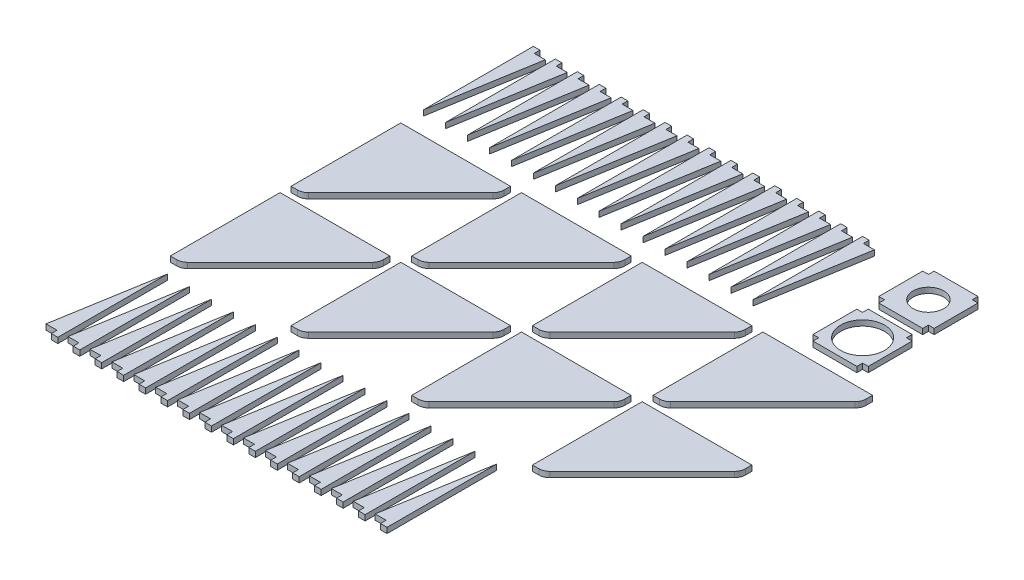
from build123d import *

# Parameters (mm, degrees)
SKETCH2_W               = 304.8
SKETCH2_H               = 304.8
BOSS_EXTRUDE1_DEPTH     = 3.175
CUT_EXTRUDE1_DEPTH      = 348.408852067
CUT_EXTRUDE1_DEPTH_BACK = 348.408852067
SKETCH3_W               = 304.8
SKETCH3_H               = 304.8
SKETCH3_R               = 12.7
SKETCH3_R_2             = 8.89


with BuildPart() as part:
    # Sketch2 → Boss-Extrude1 (new body)
    with BuildSketch(Plane(origin=(0, 0, 0), x_dir=(1, 0, 0), z_dir=(0, 1, 0))):
        with Locations((-56.763509666, -124.968808797)):
            Rectangle(SKETCH2_W, SKETCH2_H)
    extrude(amount=BOSS_EXTRUDE1_DEPTH)

    # Sketch3 → Cut-Extrude1 (cut, two sides: drawn at the far end of the back side and taken through both)
    # profile 1 of 3: a face of its own
    with BuildSketch(Plane(origin=(0, 3.175, 0), x_dir=(1, 0, 0), z_dir=(0, 1, 0)).offset(-CUT_EXTRUDE1_DEPTH_BACK)):
        with Locations((-56.763509666, -124.968808797)):
            Rectangle(SKETCH3_W, SKETCH3_H)
        Polygon((-188.253637726, -268.695366412), (-192.063637726, -268.695366412), (-192.063637726, -265.393366412), (-198.413637726, -265.393366412), (-188.253637726, -205.195366412), align=None, mode=Mode.SUBTRACT)
        Polygon((-185.713637726, -265.393366412), (-175.553637726, -205.195366412), (-175.553637726, -268.695366412), (-179.363637726, -268.695366412), (-179.363637726, -265.393366412), align=None, mode=Mode.SUBTRACT)
        Polygon((-162.853637726, -268.695366412), (-166.663637726, -268.695366412), (-166.663637726, -265.393366412), (-173.013637726, -265.393366412), (-162.853637726, -205.195366412), align=None, mode=Mode.SUBTRACT)
        Polygon((-150.153637726, -268.695366412), (-153.963637726, -268.695366412), (-153.963637726, -265.393366412), (-160.313637726, -265.393366412), (-150.153637726, -205.195366412), align=None, mode=Mode.SUBTRACT)
        Polygon((-147.613637726, -265.393366412), (-137.453637726, -205.195366412), (-137.453637726, -268.695366412), (-141.263637726, -268.695366412), (-141.263637726, -265.393366412), align=None, mode=Mode.SUBTRACT)
        Polygon((-128.563637726, -265.393366412), (-134.913637726, -265.393366412), (-124.753637726, -205.195366412), (-124.753637726, -268.695366412), (-128.563637726, -268.695366412), align=None, mode=Mode.SUBTRACT)
        Polygon((-122.213637726, -265.393366412), (-112.053637726, -205.195366412), (-112.053637726, -268.695366412), (-115.863637726, -268.695366412), (-115.863637726, -265.393366412), align=None, mode=Mode.SUBTRACT)
        Polygon((-99.353637726, -268.695366412), (-103.163637726, -268.695366412), (-103.163637726, -265.393366412), (-109.513637726, -265.393366412), (-99.353637726, -205.195366412), align=None, mode=Mode.SUBTRACT)
        Polygon((-90.463637726, -268.695366412), (-90.463637726, -265.393366412), (-96.813637726, -265.393366412), (-86.653637726, -205.195366412), (-86.653637726, -268.695366412), align=None, mode=Mode.SUBTRACT)
        Polygon((-84.113637726, -265.393366412), (-73.953637726, -205.195366412), (-73.953637726, -268.695366412), (-77.763637726, -268.695366412), (-77.763637726, -265.393366412), align=None, mode=Mode.SUBTRACT)
        Polygon((-71.413637726, -265.393366412), (-61.253637726, -205.195366412), (-61.253637726, -268.695366412), (-65.063637726, -268.695366412), (-65.063637726, -265.393366412), align=None, mode=Mode.SUBTRACT)
        with BuildLine():
            ThreePointArc((-132.963509666, -135.600090559), (-133.446874634, -138.030130355), (-134.823381605, -140.09021862))
            Line((-134.823381605, -140.09021862), (-188.253637726, -193.520474741))
            ThreePointArc((-188.253637726, -193.520474741), (-190.313725991, -194.896981712), (-192.743765787, -195.38034668))
            Line((-192.743765787, -195.38034668), (-196.463509666, -195.38034668))
            Line((-196.463509666, -195.38034668), (-196.463509666, -131.88034668))
            Line((-196.463509666, -131.88034668), (-132.963509666, -131.88034668))
            Line((-132.963509666, -131.88034668), (-132.963509666, -135.600090559))
        make_face(mode=Mode.SUBTRACT)
        with BuildLine():
            Line((-126.613509666, -195.38034668), (-126.613509666, -131.88034668))
            Line((-126.613509666, -131.88034668), (-63.113509666, -131.88034668))
            Line((-63.113509666, -131.88034668), (-63.113509666, -135.600090559))
            ThreePointArc((-63.113509666, -135.600090559), (-63.596874634, -138.030130355), (-64.973381605, -140.09021862))
            Line((-64.973381605, -140.09021862), (-118.403637726, -193.520474741))
            ThreePointArc((-118.403637726, -193.520474741), (-120.463725991, -194.896981712), (-122.893765787, -195.38034668))
            Line((-122.893765787, -195.38034668), (-126.613509666, -195.38034668))
        make_face(mode=Mode.SUBTRACT)
        Polygon((-52.363637726, -268.695366412), (-52.363637726, -265.393366412), (-58.713637726, -265.393366412), (-48.553637726, -205.195366412), (-48.553637726, -268.695366412), align=None, mode=Mode.SUBTRACT)
        Polygon((-35.853637726, -205.195366412), (-35.853637726, -268.695366412), (-39.663637726, -268.695366412), (-39.663637726, -265.393366412), (-46.013637726, -265.393366412), align=None, mode=Mode.SUBTRACT)
        Polygon((-23.153637726, -205.195366412), (-23.153637726, -268.695366412), (-26.963637726, -268.695366412), (-26.963637726, -265.393366412), (-33.313637726, -265.393366412), align=None, mode=Mode.SUBTRACT)
        Polygon((-20.613637726, -265.393366412), (-10.453637726, -205.195366412), (-10.453637726, -268.695366412), (-14.263637726, -268.695366412), (-14.263637726, -265.393366412), align=None, mode=Mode.SUBTRACT)
        Polygon((-1.563637726, -268.695366412), (-1.563637726, -265.393366412), (-7.913637726, -265.393366412), (2.246362274, -205.195366412), (2.246362274, -268.695366412), align=None, mode=Mode.SUBTRACT)
        with BuildLine():
            Line((-53.043765787, -195.38034668), (-56.763509666, -195.38034668))
            Line((-56.763509666, -195.38034668), (-56.763509666, -131.88034668))
            Line((-56.763509666, -131.88034668), (6.736490334, -131.88034668))
            Line((6.736490334, -131.88034668), (6.736490334, -135.600090559))
            ThreePointArc((6.736490334, -135.600090559), (6.253125366, -138.030130355), (4.876618395, -140.09021862))
            Line((4.876618395, -140.09021862), (-48.553637726, -193.520474741))
            ThreePointArc((-48.553637726, -193.520474741), (-50.613725991, -194.896981712), (-53.043765787, -195.38034668))
        make_face(mode=Mode.SUBTRACT)
        with BuildLine():
            Line((13.086490334, -131.88034668), (76.586490334, -131.88034668))
            Line((76.586490334, -131.88034668), (76.586490334, -135.600090559))
            ThreePointArc((76.586490334, -135.600090559), (76.103125366, -138.030130355), (74.726618395, -140.09021862))
            Line((74.726618395, -140.09021862), (21.296362274, -193.520474741))
            ThreePointArc((21.296362274, -193.520474741), (19.236274009, -194.896981712), (16.806234213, -195.38034668))
            Line((16.806234213, -195.38034668), (13.086490334, -195.38034668))
            Line((13.086490334, -195.38034668), (13.086490334, -131.88034668))
        make_face(mode=Mode.SUBTRACT)
        with BuildLine():
            Line((-196.463509666, -125.53034668), (-196.463509666, -62.03034668))
            Line((-196.463509666, -62.03034668), (-132.963509666, -62.03034668))
            Line((-132.963509666, -62.03034668), (-132.963509666, -65.750090559))
            ThreePointArc((-132.963509666, -65.750090559), (-133.10773728, -67.095783354), (-133.533868437, -68.38034668))
            ThreePointArc((-133.533868437, -68.38034668), (-134.095097913, -69.368194866), (-134.823381605, -70.24021862))
            Line((-134.823381605, -70.24021862), (-188.253637726, -123.670474741))
            ThreePointArc((-188.253637726, -123.670474741), (-189.12566148, -124.398758433), (-190.113509666, -124.959987909))
            ThreePointArc((-190.113509666, -124.959987909), (-191.398072992, -125.386119066), (-192.743765787, -125.53034668))
            Line((-192.743765787, -125.53034668), (-196.463509666, -125.53034668))
        make_face(mode=Mode.SUBTRACT)
        with BuildLine():
            Line((-122.893765787, -125.53034668), (-126.613509666, -125.53034668))
            Line((-126.613509666, -125.53034668), (-126.613509666, -62.03034668))
            Line((-126.613509666, -62.03034668), (-63.113509666, -62.03034668))
            Line((-63.113509666, -62.03034668), (-63.113509666, -65.750090559))
            ThreePointArc((-63.113509666, -65.750090559), (-63.596874634, -68.180130355), (-64.973381605, -70.24021862))
            Line((-64.973381605, -70.24021862), (-118.403637726, -123.670474741))
            ThreePointArc((-118.403637726, -123.670474741), (-120.463725991, -125.046981712), (-122.893765787, -125.53034668))
        make_face(mode=Mode.SUBTRACT)
        Polygon((-196.463509666, -48.768808797), (-196.463509666, 14.731191203), (-192.653509666, 14.731191203), (-192.653509666, 11.429191203), (-186.303509666, 11.429191203), align=None, mode=Mode.SUBTRACT)
        Polygon((-183.763509666, 14.731191203), (-179.953509666, 14.731191203), (-179.953509666, 11.429191203), (-173.603509666, 11.429191203), (-183.763509666, -48.768808797), align=None, mode=Mode.SUBTRACT)
        Polygon((-171.063509666, 14.731191203), (-167.253509666, 14.731191203), (-167.253509666, 11.429191203), (-160.903509666, 11.429191203), (-171.063509666, -48.768808797), align=None, mode=Mode.SUBTRACT)
        Polygon((-158.363509666, 14.731191203), (-154.553509666, 14.731191203), (-154.553509666, 11.429191203), (-148.203509666, 11.429191203), (-158.363509666, -48.768808797), align=None, mode=Mode.SUBTRACT)
        Polygon((-145.663509666, 14.731191203), (-141.853509666, 14.731191203), (-141.853509666, 11.429191203), (-135.503509666, 11.429191203), (-145.663509666, -48.768808797), align=None, mode=Mode.SUBTRACT)
        Polygon((-132.963509666, 14.731191203), (-129.153509666, 14.731191203), (-129.153509666, 11.429191203), (-122.803509666, 11.429191203), (-132.963509666, -48.768808797), align=None, mode=Mode.SUBTRACT)
        Polygon((-120.263509666, 14.731191203), (-116.453509666, 14.731191203), (-116.453509666, 11.429191203), (-110.103509666, 11.429191203), (-120.263509666, -48.768808797), align=None, mode=Mode.SUBTRACT)
        Polygon((-107.563509666, 14.731191203), (-103.753509666, 14.731191203), (-103.753509666, 11.429191203), (-97.403509666, 11.429191203), (-107.563509666, -48.768808797), align=None, mode=Mode.SUBTRACT)
        Polygon((-94.863509666, 14.731191203), (-91.053509666, 14.731191203), (-91.053509666, 11.429191203), (-84.703509666, 11.429191203), (-94.863509666, -48.768808797), align=None, mode=Mode.SUBTRACT)
        Polygon((-82.163509666, 14.731191203), (-78.353509666, 14.731191203), (-78.353509666, 11.429191203), (-72.003509666, 11.429191203), (-82.163509666, -48.768808797), align=None, mode=Mode.SUBTRACT)
        Polygon((-69.463509666, 14.731191203), (-65.653509666, 14.731191203), (-65.653509666, 11.429191203), (-59.303509666, 11.429191203), (-69.463509666, -48.768808797), align=None, mode=Mode.SUBTRACT)
        with BuildLine():
            Line((-53.043765787, -125.53034668), (-56.763509666, -125.53034668))
            Line((-56.763509666, -125.53034668), (-56.763509666, -62.03034668))
            Line((-56.763509666, -62.03034668), (6.736490334, -62.03034668))
            Line((6.736490334, -62.03034668), (6.736490334, -65.750090559))
            ThreePointArc((6.736490334, -65.750090559), (6.253125366, -68.180130355), (4.876618395, -70.24021862))
            Line((4.876618395, -70.24021862), (-48.553637726, -123.670474741))
            ThreePointArc((-48.553637726, -123.670474741), (-50.613725991, -125.046981712), (-53.043765787, -125.53034668))
        make_face(mode=Mode.SUBTRACT)
        with BuildLine():
            Line((16.806234213, -125.53034668), (13.086490334, -125.53034668))
            Line((13.086490334, -125.53034668), (13.086490334, -62.03034668))
            Line((13.086490334, -62.03034668), (76.586490334, -62.03034668))
            Line((76.586490334, -62.03034668), (76.586490334, -65.750090559))
            ThreePointArc((76.586490334, -65.750090559), (76.103125366, -68.180130355), (74.726618395, -70.24021862))
            Line((74.726618395, -70.24021862), (21.296362274, -123.670474741))
            ThreePointArc((21.296362274, -123.670474741), (19.236274009, -125.046981712), (16.806234213, -125.53034668))
        make_face(mode=Mode.SUBTRACT)
        Polygon((-56.763509666, 14.731191203), (-52.953509666, 14.731191203), (-52.953509666, 11.429191203), (-46.603509666, 11.429191203), (-56.763509666, -48.768808797), align=None, mode=Mode.SUBTRACT)
        Polygon((-44.063509666, 14.731191203), (-40.253509666, 14.731191203), (-40.253509666, 11.429191203), (-33.903509666, 11.429191203), (-44.063509666, -48.768808797), align=None, mode=Mode.SUBTRACT)
        Polygon((-31.363509666, 14.731191203), (-27.553509666, 14.731191203), (-27.553509666, 11.429191203), (-21.203509666, 11.429191203), (-31.363509666, -48.768808797), align=None, mode=Mode.SUBTRACT)
        Polygon((-18.663509666, 14.731191203), (-14.853509666, 14.731191203), (-14.853509666, 11.429191203), (-8.503509666, 11.429191203), (-18.663509666, -48.768808797), align=None, mode=Mode.SUBTRACT)
        Polygon((-5.963509666, 14.731191203), (-2.153509666, 14.731191203), (-2.153509666, 11.429191203), (4.196490334, 11.429191203), (-5.963509666, -48.768808797), align=None, mode=Mode.SUBTRACT)
        Polygon((57.536490334, -48.768808797), (57.536490334, -52.070808797), (32.136490334, -52.070808797), (32.136490334, -48.768808797), (28.834490334, -48.768808797), (28.834490334, -23.368808797), (32.136490334, -23.368808797), (32.136490334, -20.066808797), (57.536490334, -20.066808797), (57.536490334, -23.368808797), (60.838490334, -23.368808797), (60.838490334, -48.768808797), align=None, mode=Mode.SUBTRACT)
        Polygon((28.834490334, 14.731191203), (32.136490334, 14.731191203), (32.136490334, 18.033191203), (57.536490334, 18.033191203), (57.536490334, 14.731191203), (60.838490334, 14.731191203), (60.838490334, -10.668808797), (57.536490334, -10.668808797), (57.536490334, -13.970808797), (32.136490334, -13.970808797), (32.136490334, -10.668808797), (28.834490334, -10.668808797), align=None, mode=Mode.SUBTRACT)
    # profile 2 of 3: a face of its own
    with BuildSketch(Plane(origin=(0, 3.175, 0), x_dir=(1, 0, 0), z_dir=(0, 1, 0)).offset(-CUT_EXTRUDE1_DEPTH_BACK)):
        with Locations(Location((44.836490334, -36.068808797, 0), (0, 0, 270))):
            Circle(SKETCH3_R)
    # profile 3 of 3: a face of its own
    with BuildSketch(Plane(origin=(0, 3.175, 0), x_dir=(1, 0, 0), z_dir=(0, 1, 0)).offset(-CUT_EXTRUDE1_DEPTH_BACK)):
        with Locations(Location((44.836490334, 2.031191203, 0), (0, 0, 270))):
            Circle(SKETCH3_R_2)
    extrude(amount=CUT_EXTRUDE1_DEPTH + CUT_EXTRUDE1_DEPTH_BACK, mode=Mode.SUBTRACT)


solid = part.part
